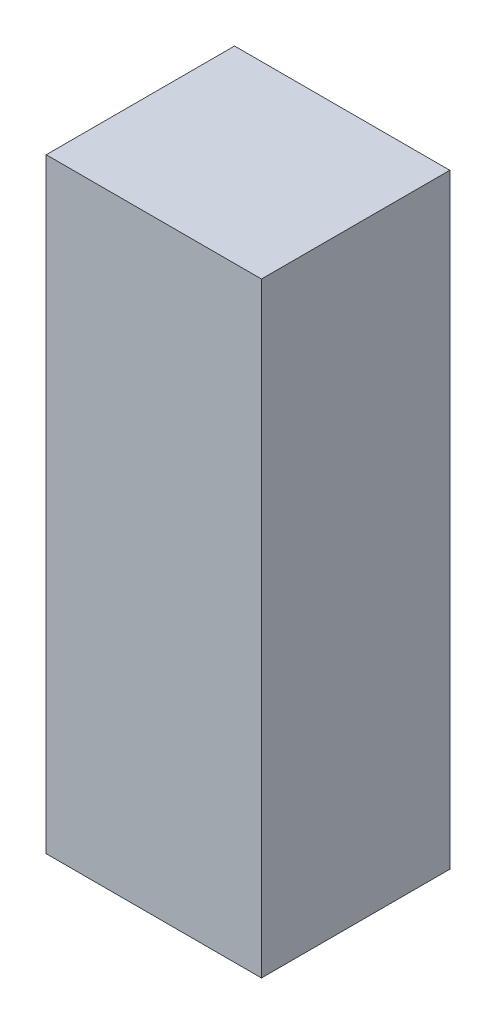
from build123d import *

# Parameters (mm, degrees)
SKETCH1_W           = 20.32
SKETCH1_H           = 17.78
BOSS_EXTRUDE1_DEPTH = 57.15


with BuildPart() as part:
    # Sketch1 → Boss-Extrude1 (new body)
    with BuildSketch(Plane(origin=(0, 0, 0), x_dir=(1, 0, 0), z_dir=(0, 1, 0))):
        with Locations((-24.833418177, 34.349833903)):
            Rectangle(SKETCH1_W, SKETCH1_H)
    extrude(amount=BOSS_EXTRUDE1_DEPTH)


solid = part.part
